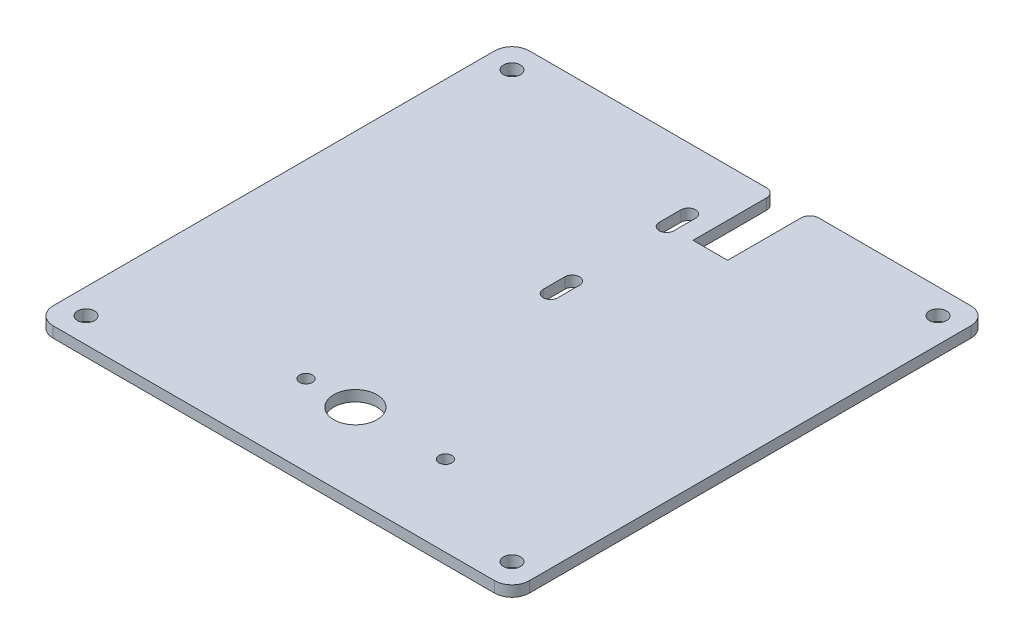
from build123d import *

# Parameters (mm, degrees)
SKETCH1_W           = 139.7
SKETCH1_H           = 139.7
SKETCH1_R           = 2.4892
BOSS_EXTRUDE1_DEPTH = 3.175
SKETCH2_W           = 10.16
SKETCH2_H           = 24.13
CUT_EXTRUDE2_DEPTH  = 3.175
SKETCH3_R           = 6.35
SKETCH3_R_2         = 1.905
CUT_EXTRUDE4_DEPTH  = 3.175
FILLET2_R           = 5.08
FILLET3_R           = 5.08
FILLET4_R           = 5.08
FILLET5_R           = 5.08
FILLET6_R           = 2.54
FILLET8_R           = 2.54


with BuildPart() as part:
    # Sketch1 → Boss-Extrude1 (new body)
    with BuildSketch(Plane(origin=(0, 0, 0), x_dir=(1, 0, 0), z_dir=(0, 1, 0))):
        Rectangle(SKETCH1_W, SKETCH1_H)
        with Locations(Location((62.484, -62.484, 0), (0, 0, 270))):
            Circle(SKETCH1_R, mode=Mode.SUBTRACT)
        with Locations(Location((-62.484, 62.484, 0), (0, 0, 270))):
            Circle(SKETCH1_R, mode=Mode.SUBTRACT)
        with Locations(Location((62.484, 62.484, 0), (0, 0, 270))):
            Circle(SKETCH1_R, mode=Mode.SUBTRACT)
        with Locations(Location((-62.484, -62.484, 0), (0, 0, 270))):
            Circle(SKETCH1_R, mode=Mode.SUBTRACT)
    extrude(amount=BOSS_EXTRUDE1_DEPTH)

    # Sketch2 → Cut-Extrude2 (cut)
    with BuildSketch(Plane(origin=(0, 3.175, 0), x_dir=(1, 0, 0), z_dir=(0, 1, 0))):
        with Locations((12.46265, 57.785)):
            Rectangle(SKETCH2_W, SKETCH2_H)
        with BuildLine():
            ThreePointArc((-2.15265, 45.344), (0, 43.19135), (2.15265, 45.344))
            Line((2.15265, 45.344), (2.15265, 51.694))
            ThreePointArc((2.15265, 51.694), (0, 53.84665), (-2.15265, 51.694))
            Line((-2.15265, 51.694), (-2.15265, 45.344))
        make_face()
        with BuildLine():
            ThreePointArc((2.15265, 17.658), (0, 19.81065), (-2.15265, 17.658))
            Line((-2.15265, 17.658), (-2.15265, 11.308))
            ThreePointArc((-2.15265, 11.308), (0, 9.15535), (2.15265, 11.308))
            Line((2.15265, 11.308), (2.15265, 17.658))
        make_face()
    extrude(amount=-CUT_EXTRUDE2_DEPTH, mode=Mode.SUBTRACT)

    # Sketch3 → Cut-Extrude4 (cut)
    with BuildSketch(Plane(origin=(0, 3.175, 0), x_dir=(1, 0, 0), z_dir=(0, 1, 0))):
        with Locations(Location((0.254, -46.198145278, 0), (0, 0, 270))):
            Circle(SKETCH3_R)
        with Locations(Location((26.67, -46.198145278, 0), (0, 0, 270))):
            Circle(SKETCH3_R_2)
        with Locations(Location((-14.224, -46.198145278, 0), (0, 0, 270))):
            Circle(SKETCH3_R_2)
    extrude(amount=-CUT_EXTRUDE4_DEPTH, mode=Mode.SUBTRACT)

    # Fillet2
    fillet2_edges = [part.edges().sort_by_distance(p)[0] for p in [
        (-69.85, 1.5875, 69.85),
    ]]
    fillet(fillet2_edges, radius=FILLET2_R)

    # Fillet3
    fillet3_edges = [part.edges().sort_by_distance(p)[0] for p in [
        (69.85, 1.5875, 69.85),
    ]]
    fillet(fillet3_edges, radius=FILLET3_R)

    # Fillet4
    fillet4_edges = [part.edges().sort_by_distance(p)[0] for p in [
        (69.85, 1.5875, -69.85),
    ]]
    fillet(fillet4_edges, radius=FILLET4_R)

    # Fillet5
    fillet5_edges = [part.edges().sort_by_distance(p)[0] for p in [
        (-69.85, 1.5875, -69.85),
    ]]
    fillet(fillet5_edges, radius=FILLET5_R)

    # Fillet6
    fillet6_edges = [part.edges().sort_by_distance(p)[0] for p in [
        (7.38265, 1.5875, -69.85),
    ]]
    fillet(fillet6_edges, radius=FILLET6_R)

    # Fillet8
    fillet8_edges = [part.edges().sort_by_distance(p)[0] for p in [
        (17.54265, 1.5875, -69.85),
    ]]
    fillet(fillet8_edges, radius=FILLET8_R)


solid = part.part
